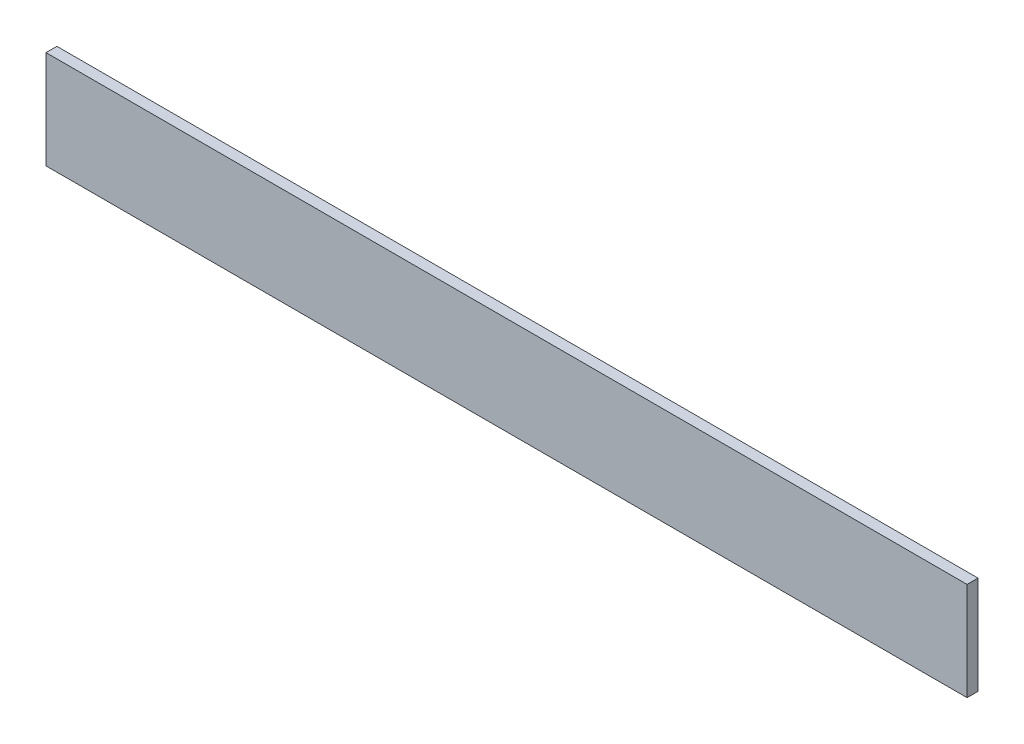
from build123d import *

# Parameters (mm, degrees)
SKETCH1_W           = 169
SKETCH1_H           = 18
BOSS_EXTRUDE1_DEPTH = 2


with BuildPart() as part:
    # Sketch1 → Boss-Extrude1 (new body)
    with BuildSketch(Plane.XY):
        Rectangle(SKETCH1_W, SKETCH1_H)
    extrude(amount=BOSS_EXTRUDE1_DEPTH)


solid = part.part
